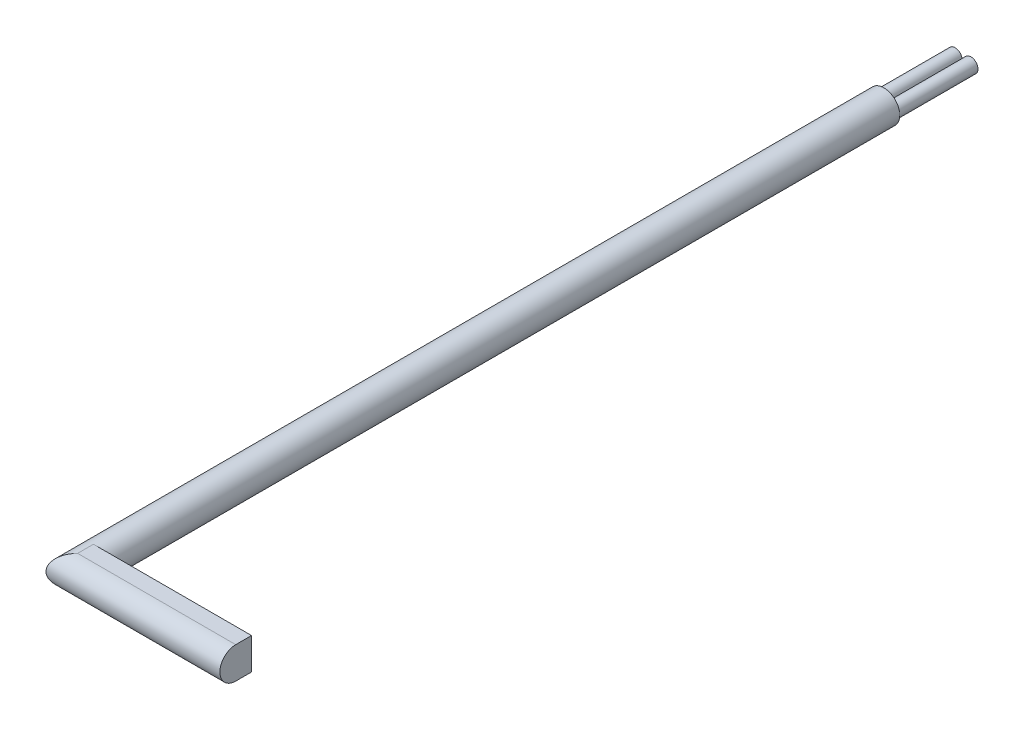
from build123d import *

# Parameters (mm, degrees)
SKETCH1_R           = 1
BOSS_EXTRUDE1_DEPTH = 50
SKETCH2_W           = 10
SKETCH2_H           = 2
BOSS_EXTRUDE2_DEPTH = 2
BOSS_EXTRUDE3_DEPTH = 2
CUT_EXTRUDE1_REACH  = 55.16
SKETCH5_R           = 0.45
BOSS_EXTRUDE4_DEPTH = 5


with BuildPart() as part:
    # Sketch1 → Boss-Extrude1 (new body)
    with BuildSketch(Plane.XY):
        Circle(SKETCH1_R)
    extrude(amount=BOSS_EXTRUDE1_DEPTH)

    # Sketch2 → Boss-Extrude2 (add)
    with BuildSketch(Plane.XY.offset(50)):
        with Locations((5, 0)):
            Rectangle(SKETCH2_W, SKETCH2_H)
    extrude(amount=BOSS_EXTRUDE2_DEPTH)

    # Sketch3 → Boss-Extrude3 (add)
    with BuildSketch(Plane.XY.offset(50)):
        with BuildLine():
            Line((0, -1), (0, 1))
            ThreePointArc((0, 1), (-1, 0), (0, -1))
        make_face()
    extrude(amount=BOSS_EXTRUDE3_DEPTH)

    # Sketch4 → Cut-Extrude1 (cut, up to next)
    with BuildSketch(Plane(origin=(10, 0, 0), x_dir=(0, 0, -1), z_dir=(1, 0, 0)), mode=Mode.PRIVATE) as cut_extrude1_sk1:
        with BuildLine():
            ThreePointArc((-52, 0), (-51.707106781, 0.707106781), (-51, 1))
            Line((-51, 1), (-52, 1))
            Line((-52, 1), (-52, 0))
        make_face()
    cut_extrude1_tool1 = extrude(cut_extrude1_sk1.sketch, amount=-CUT_EXTRUDE1_REACH, mode=Mode.PRIVATE) & part.part
    # Sketch4 → Cut-Extrude1 (cut, up to next)
    with BuildSketch(Plane(origin=(10, 0, 0), x_dir=(0, 0, -1), z_dir=(1, 0, 0)), mode=Mode.PRIVATE) as cut_extrude1_sk2:
        with BuildLine():
            Line((-52, -1), (-51, -1))
            ThreePointArc((-51, -1), (-51.707106781, -0.707106781), (-52, 0))
            Line((-52, 0), (-52, -1))
        make_face()
    cut_extrude1_tool2 = extrude(cut_extrude1_sk2.sketch, amount=-CUT_EXTRUDE1_REACH, mode=Mode.PRIVATE) & part.part
    add(cut_extrude1_tool1.solids().sort_by_distance((10, 0.776632, 51.776632))[0], mode=Mode.SUBTRACT)
    add(cut_extrude1_tool2.solids().sort_by_distance((10, -0.776632, 51.776632))[0], mode=Mode.SUBTRACT)

    # Sketch5 → Boss-Extrude4 (add)
    with BuildSketch(Plane(origin=(0, 0, 0), x_dir=(-1, 0, 0), z_dir=(0, 0, -1))):
        with Locations(Location((0.5, 0, 0), (0, 0, 180))):
            Circle(SKETCH5_R)
        with Locations(Location((-0.5, 0, 0), (0, 0, 180))):
            Circle(SKETCH5_R)
    extrude(amount=BOSS_EXTRUDE4_DEPTH)


solid = part.part
